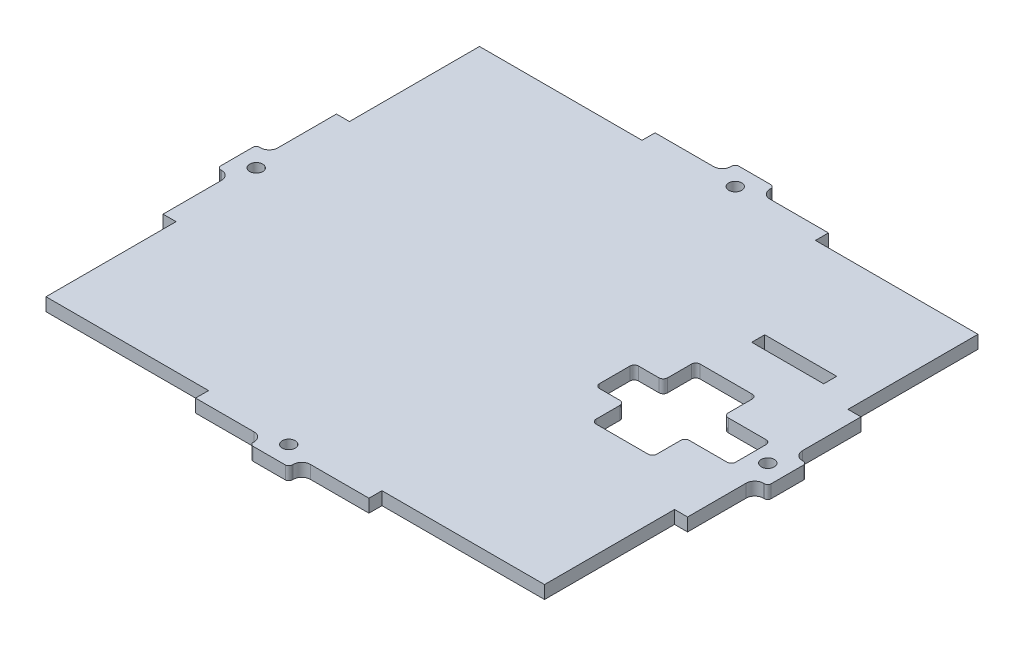
from build123d import *

# Parameters (mm, degrees)
ESBO_O1_W                = 115
ESBO_O1_H                = 100
RESSALTO_EXTRUS_O1_DEPTH = 1.5
RESSALTO_EXTRUS_O2_DEPTH = 3
ESBO_O2_R                = 1.5
CORTE_EXTRUS_O1_DEPTH    = 85.718652019
CUT_EXTRUDE3_DEPTH       = 85.678804904
CUT_EXTRUDE3_DEPTH_BACK  = 85.678804904
SKETCH2_W                = 16.6
SKETCH2_H                = 3


with BuildPart() as part:
    # Esboço1 → Ressalto-extrusão1 (new, symmetric)
    with BuildSketch(Plane(origin=(0, 0, 0), x_dir=(1, 0, 0), z_dir=(0, 1, 0))):
        Rectangle(ESBO_O1_W, ESBO_O1_H)
    extrude(amount=RESSALTO_EXTRUS_O1_DEPTH, both=True)

    # Esboço4 → Ressalto-extrusão2 (add, through all)
    with BuildSketch(Plane(origin=(0, 1.5, 0), x_dir=(1, 0, 0), z_dir=(0, 1, 0))):
        with BuildLine():
            Line((6.5, 53), (20, 53))
            Line((20, 53), (20, 50))
            Line((20, 50), (-20, 50))
            Line((-20, 50), (-20, 53))
            Line((-20, 53), (-6.5, 53))
            ThreePointArc((-6.5, 53), (-5.085786438, 53.585786438), (-4.5, 55))
            Line((-4.5, 55), (-4.5, 55.2))
            ThreePointArc((-4.5, 55.2), (-4.265685425, 55.765685425), (-3.7, 56))
            Line((-3.7, 56), (3.7, 56))
            ThreePointArc((3.7, 56), (4.265685425, 55.765685425), (4.5, 55.2))
            Line((4.5, 55.2), (4.5, 55))
            ThreePointArc((4.5, 55), (5.085786438, 53.585786438), (6.5, 53))
        make_face()
        with BuildLine():
            Line((-63.5, 3.7), (-63.5, -3.7))
            ThreePointArc((-63.5, -3.7), (-63.265685425, -4.265685425), (-62.7, -4.5))
            Line((-62.7, -4.5), (-62.5, -4.5))
            ThreePointArc((-62.5, -4.5), (-61.085786438, -5.085786438), (-60.5, -6.5))
            Line((-60.5, -6.5), (-60.5, -20))
            Line((-60.5, -20), (-57.5, -20))
            Line((-57.5, -20), (-57.5, 20))
            Line((-57.5, 20), (-60.5, 20))
            Line((-60.5, 20), (-60.5, 6.5))
            ThreePointArc((-60.5, 6.5), (-61.085786438, 5.085786438), (-62.5, 4.5))
            Line((-62.5, 4.5), (-62.7, 4.5))
            ThreePointArc((-62.7, 4.5), (-63.265685425, 4.265685425), (-63.5, 3.7))
        make_face()
        with BuildLine():
            Line((4.5, -55.2), (4.5, -55))
            ThreePointArc((4.5, -55), (5.085786438, -53.585786438), (6.5, -53))
            Line((6.5, -53), (20, -53))
            Line((20, -53), (20, -50))
            Line((20, -50), (-20, -50))
            Line((-20, -50), (-20, -53))
            Line((-20, -53), (-6.5, -53))
            ThreePointArc((-6.5, -53), (-5.085786438, -53.585786438), (-4.5, -55))
            Line((-4.5, -55), (-4.5, -55.2))
            ThreePointArc((-4.5, -55.2), (-4.265685425, -55.765685425), (-3.7, -56))
            Line((-3.7, -56), (3.7, -56))
            ThreePointArc((3.7, -56), (4.265685425, -55.765685425), (4.5, -55.2))
        make_face()
        with BuildLine():
            Line((57.5, 20), (60.5, 20))
            Line((60.5, 20), (60.5, 6.5))
            ThreePointArc((60.5, 6.5), (61.085786438, 5.085786438), (62.5, 4.5))
            Line((62.5, 4.5), (62.7, 4.5))
            ThreePointArc((62.7, 4.5), (63.265685425, 4.265685425), (63.5, 3.7))
            Line((63.5, 3.7), (63.5, -3.7))
            ThreePointArc((63.5, -3.7), (63.265685425, -4.265685425), (62.7, -4.5))
            Line((62.7, -4.5), (62.5, -4.5))
            ThreePointArc((62.5, -4.5), (61.085786438, -5.085786438), (60.5, -6.5))
            Line((60.5, -6.5), (60.5, -20))
            Line((60.5, -20), (57.5, -20))
            Line((57.5, -20), (57.5, 20))
        make_face()
    extrude(amount=-RESSALTO_EXTRUS_O2_DEPTH)

    # Esboço2 → Corte-extrusão1 (cut, through all)
    with BuildSketch(Plane(origin=(0, 1.5, 0), x_dir=(1, 0, 0), z_dir=(0, 1, 0))):
        with Locations(Location((0, -51.5, 0), (0, 0, 270))):
            Circle(ESBO_O2_R)
        with Locations(Location((0, 51.5, 0), (0, 0, 90))):
            Circle(ESBO_O2_R)
        with Locations(Location((59, 0, 0), (0, 0, 90))):
            Circle(ESBO_O2_R)
        with Locations(Location((-59, 0, 0), (0, 0, 270))):
            Circle(ESBO_O2_R)
    extrude(amount=-CORTE_EXTRUS_O1_DEPTH, mode=Mode.SUBTRACT)

    # Sketch2 → Cut-Extrude3 (cut, two sides: drawn at the far end of the back side and taken through both)
    with BuildSketch(Plane(origin=(0, 0, 0), x_dir=(1, 0, 0), z_dir=(0, 1, 0)).offset(-CUT_EXTRUDE3_DEPTH_BACK)):
        with BuildLine():
            Line((24.7, 4.5), (29.4, 4.5))
            ThreePointArc((29.4, 4.5), (30.107106781, 4.792893219), (30.4, 5.5))
            Line((30.4, 5.5), (30.4, 11))
            ThreePointArc((30.4, 11), (30.692893219, 11.707106781), (31.4, 12))
            Line((31.4, 12), (43.4, 12))
            ThreePointArc((43.4, 12), (44.107106781, 11.707106781), (44.4, 11))
            Line((44.4, 11), (44.4, 5.5))
            ThreePointArc((44.4, 5.5), (44.692893219, 4.792893219), (45.4, 4.5))
            Line((45.4, 4.5), (54.1, 4.5))
            ThreePointArc((54.1, 4.5), (54.807106781, 4.207106781), (55.1, 3.5))
            Line((55.1, 3.5), (55.1, -3.5))
            ThreePointArc((55.1, -3.5), (54.807106781, -4.207106781), (54.1, -4.5))
            Line((54.1, -4.5), (45.4, -4.5))
            ThreePointArc((45.4, -4.5), (44.692893219, -4.792893219), (44.4, -5.5))
            Line((44.4, -5.5), (44.4, -11))
            ThreePointArc((44.4, -11), (44.107106781, -11.707106781), (43.4, -12))
            Line((43.4, -12), (31.4, -12))
            ThreePointArc((31.4, -12), (30.692893219, -11.707106781), (30.4, -11))
            Line((30.4, -11), (30.4, -5.5))
            ThreePointArc((30.4, -5.5), (30.107106781, -4.792893219), (29.4, -4.5))
            Line((29.4, -4.5), (24.7, -4.5))
            ThreePointArc((24.7, -4.5), (23.992893219, -4.207106781), (23.7, -3.5))
            Line((23.7, -3.5), (23.7, 3.5))
            ThreePointArc((23.7, 3.5), (23.992893219, 4.207106781), (24.7, 4.5))
        make_face()
        with Locations((41.3, 23.8)):
            Rectangle(SKETCH2_W, SKETCH2_H)
    extrude(amount=CUT_EXTRUDE3_DEPTH + CUT_EXTRUDE3_DEPTH_BACK, mode=Mode.SUBTRACT)


solid = part.part
